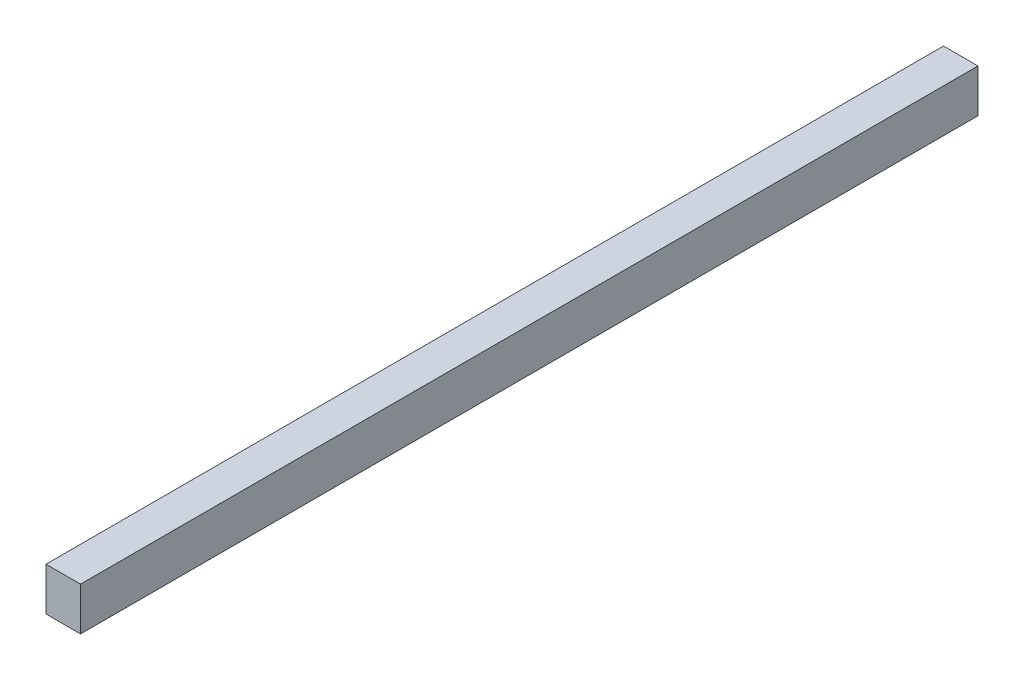
from build123d import *

# Parameters (mm, degrees)
SKETCH_1_W      = 4
SKETCH_1_H      = 5
EXTRUDE_1_DEPTH = 52


with BuildPart() as part:
    # 草图1 → 凸台-拉伸1 (new, symmetric)
    with BuildSketch(Plane.XY):
        with Locations((2, 2.5)):
            Rectangle(SKETCH_1_W, SKETCH_1_H)
    extrude(amount=EXTRUDE_1_DEPTH, both=True)


solid = part.part
